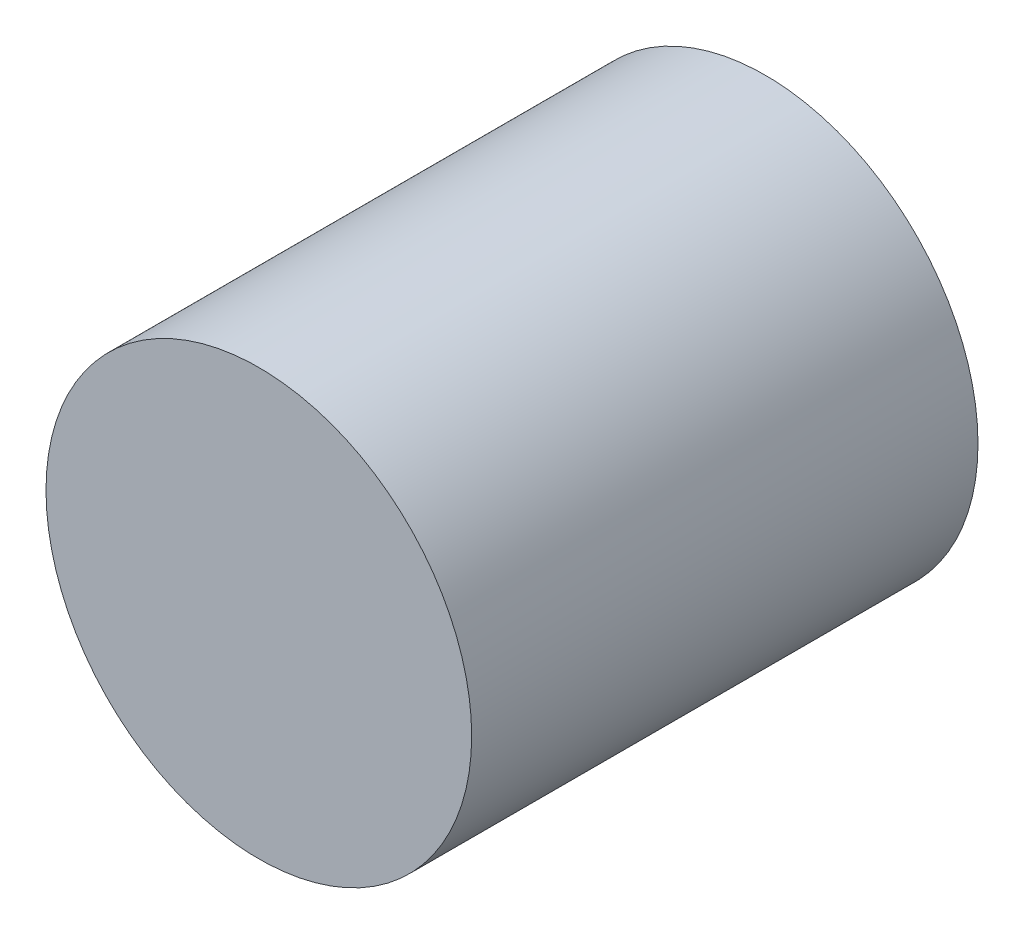
from build123d import *

# Parameters (mm, degrees)
SKETCH2_R           = 5.7
BOSS_EXTRUDE2_DEPTH = 13.56


with BuildPart() as part:
    # Sketch2 → Boss-Extrude2 (new body)
    with BuildSketch(Plane.XY):
        Circle(SKETCH2_R)
    extrude(amount=BOSS_EXTRUDE2_DEPTH)


solid = part.part
